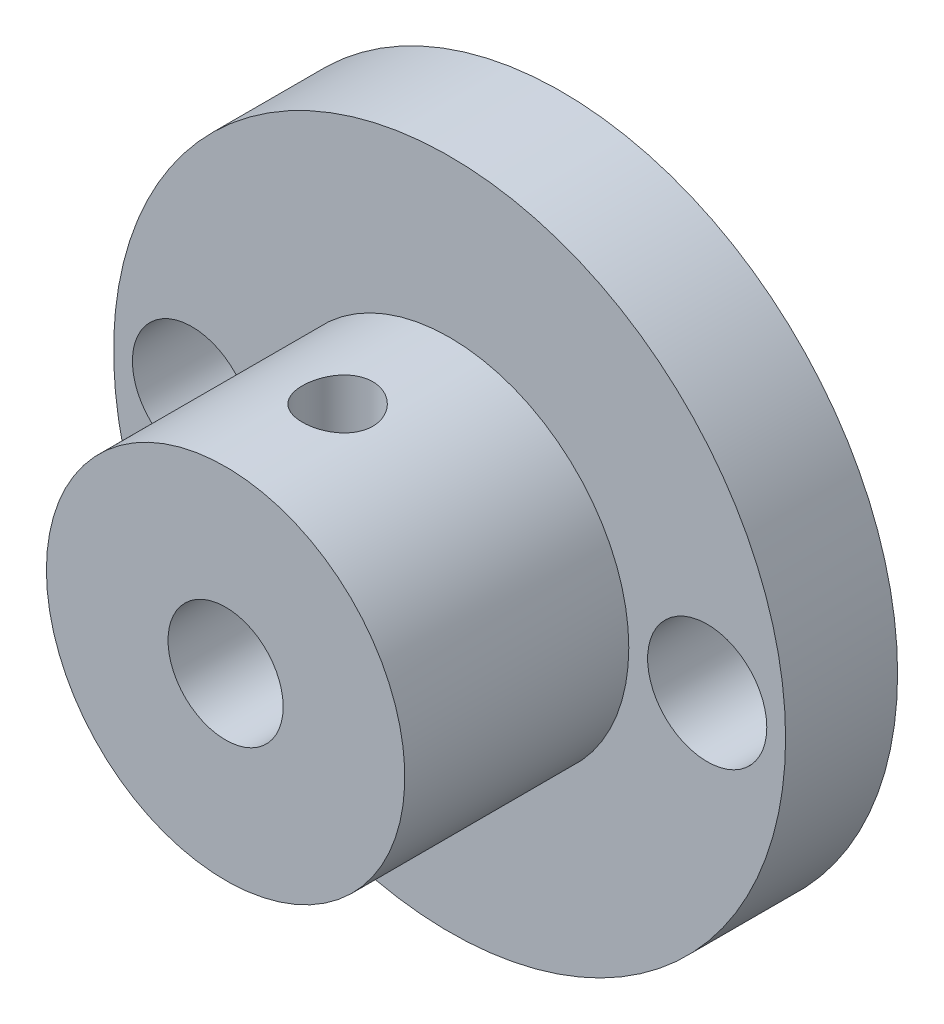
from build123d import *

# Parameters (mm, degrees)
SKETCH1_R                  = 19.05
BOSS_EXTRUDE1_DEPTH        = 6.35
SKETCH2_R                  = 10.16
BOSS_EXTRUDE2_DEPTH        = 19.05
F_0_257_DIAMETER_HOLE1_D   = 6.5278
F_10_24_TAPPED_HOLE3_D     = 3.9878
F_10_24_TAPPED_HOLE3_DEPTH = 10.159
F_10_24_TAPPED_HOLE3_TIP   = 1.198055988
H_0_266_DIAMETER_HOLE1_D   = 6.7564


with BuildPart() as part:
    # Sketch1 → Boss-Extrude1 (new body)
    with BuildSketch(Plane.XY):
        Circle(SKETCH1_R)
    extrude(amount=BOSS_EXTRUDE1_DEPTH)

    # Sketch2 → Boss-Extrude2 (add)
    with BuildSketch(Plane(origin=(0, 0, 0), x_dir=(-1, 0, 0), z_dir=(0, 0, -1))):
        Circle(SKETCH2_R)
    extrude(amount=-BOSS_EXTRUDE2_DEPTH)

    # F (0.257) Diameter Hole1 (through all)
    with Locations(Plane.XY.offset(19.05)):
        with Locations((0, 0)):
            Hole(F_0_257_DIAMETER_HOLE1_D / 2)

    # #10-24 Tapped Hole3
    with Locations(Plane(origin=(0, 10.16, 12.7), x_dir=(0, 0, 1), z_dir=(0, 1, 0))):
        with Locations((0, 0)):
            Hole(F_10_24_TAPPED_HOLE3_D / 2, depth=F_10_24_TAPPED_HOLE3_DEPTH)
            with Locations((0, 0, -(F_10_24_TAPPED_HOLE3_DEPTH + F_10_24_TAPPED_HOLE3_TIP / 2))):  # 118° drill point
                Cone(0, F_10_24_TAPPED_HOLE3_D / 2, F_10_24_TAPPED_HOLE3_TIP, mode=Mode.SUBTRACT)

    # H (0.266) Diameter Hole1 (through all)
    with Locations(Plane.XY.offset(6.35)):
        with Locations((-14.605, 0), (14.605, 0)):
            Hole(H_0_266_DIAMETER_HOLE1_D / 2)


solid = part.part
